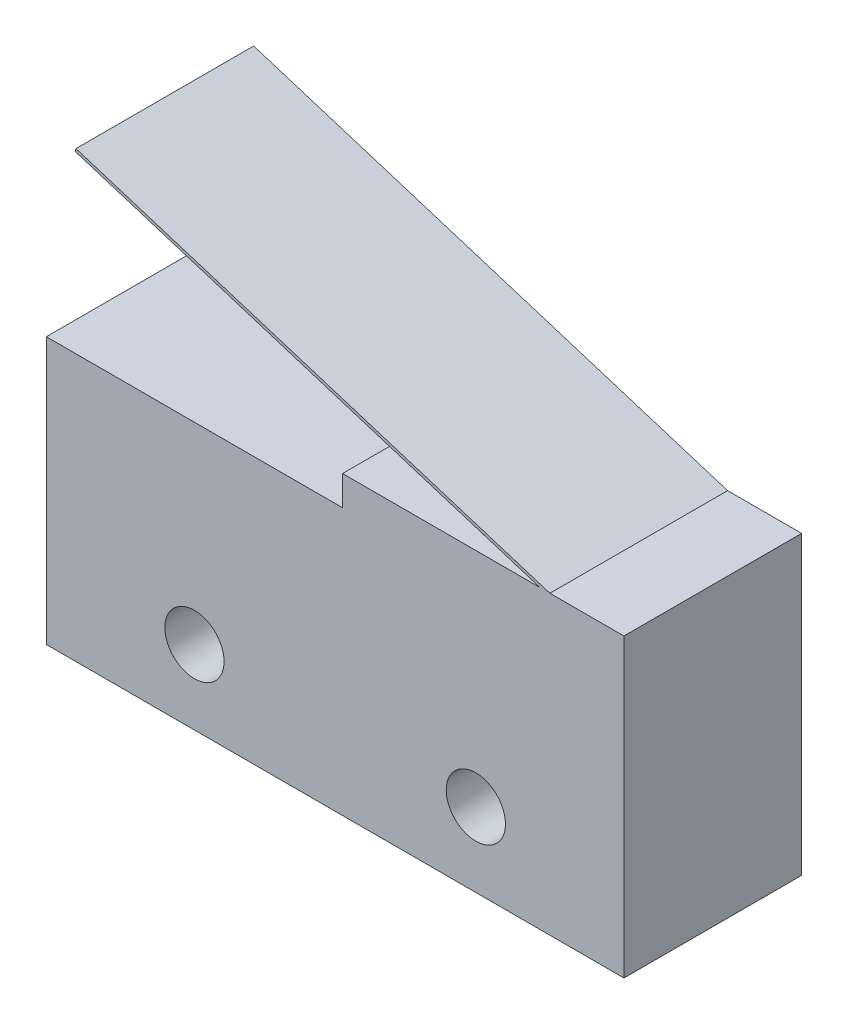
from build123d import *

# Parameters (mm, degrees)
SKETCH1_R           = 1
BOSS_EXTRUDE1_DEPTH = 6
BOSS_EXTRUDE2_DEPTH = 6


with BuildPart() as part:
    # Sketch1 → Boss-Extrude1 (new body)
    with BuildSketch(Plane.XY):
        Polygon((-9.75, 4), (0.25, 4), (0.25, 5), (9.75, 5), (9.75, -5), (-9.75, -5), align=None)
        with Locations((-4.75, -2.5)):
            Circle(SKETCH1_R, mode=Mode.SUBTRACT)
        with Locations(Location((4.75, -2.5, 0), (0, 0, 180))):
            Circle(SKETCH1_R, mode=Mode.SUBTRACT)
    extrude(amount=BOSS_EXTRUDE1_DEPTH)

    # Sketch2 → Boss-Extrude2 (add)
    with BuildSketch(Plane(origin=(0, 0, 0), x_dir=(-1, 0, 0), z_dir=(0, 0, -1))):
        Polygon((-7.25, 5), (8.75, 10), (8.779827499, 9.904552002), (-6.914738908, 5), align=None)
    extrude(amount=-BOSS_EXTRUDE2_DEPTH)


solid = part.part
